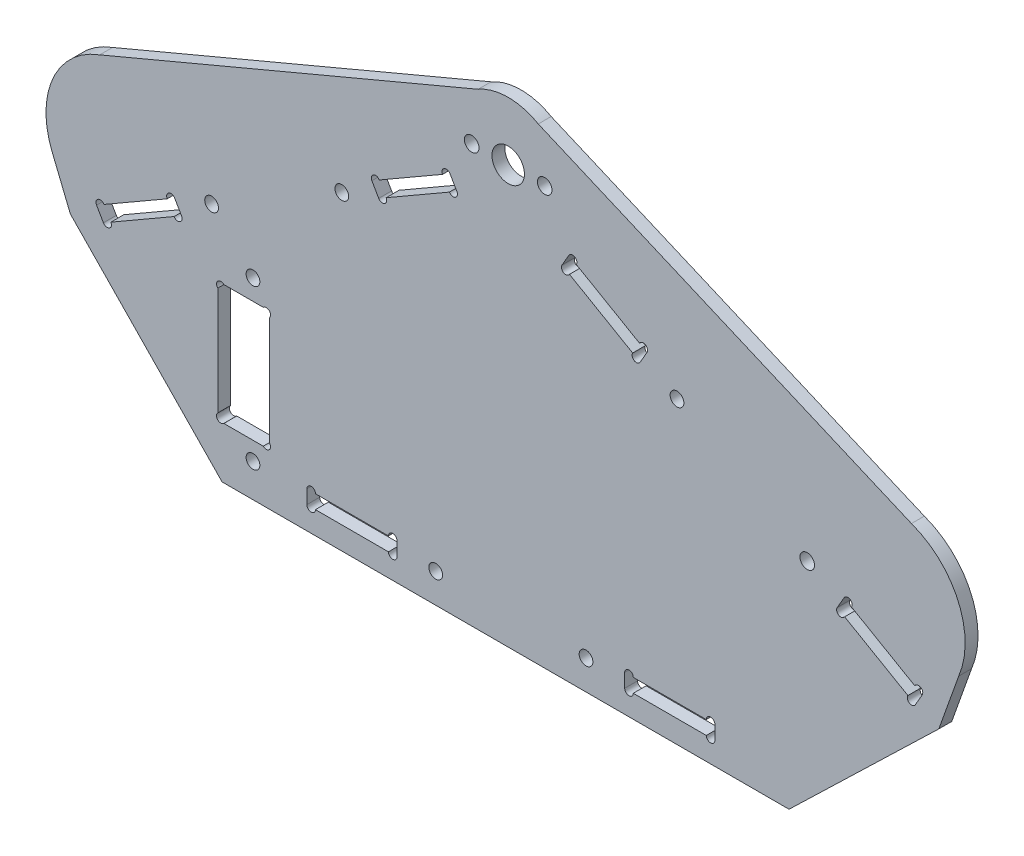
from build123d import *

# Parameters (mm, degrees)
MODEL_R             = 3.781579339
MODEL_R_2           = 1.7
MODEL_R_3           = 1.6
MODEL_W             = 12
MODEL_H             = 28
BOSS_EXTRUDE2_DEPTH = 3
SKETCH1_R           = 1.0005
CUT_EXTRUDE1_DEPTH  = 312.964229084


with BuildPart() as part:
    # Model → Boss-Extrude2 (new body)
    with BuildSketch(Plane.XY):
        with BuildLine():
            Line((88, 60), (220, 60))
            Line((220, 60), (254.882583618, 93.640518188))
            Line((254.882583618, 93.640518188), (259.489592216, 106.576108559))
            ThreePointArc((259.489592216, 106.576108559), (259.424141413, 121.57623231), (248.498382723, 131.854159795))
            Line((248.498382723, 131.854159795), (161.617078665, 168.980084934))
            ThreePointArc((161.617078665, 168.980084934), (154.617078665, 170.855729281), (147.617078665, 168.980084934))
            Line((147.617078665, 168.980084934), (59.501617277, 131.854159795))
            ThreePointArc((59.501617277, 131.854159795), (48.575858587, 121.57623231), (48.510407784, 106.576108559))
            Line((48.510407784, 106.576108559), (52.677086204, 96.362955936))
            Line((52.677086204, 96.362955936), (88, 60))
        make_face()
        with Locations((154.617078665, 157.237991333)):
            Circle(MODEL_R, mode=Mode.SUBTRACT)
        with Locations((163.114624023, 157.237991333)):
            Circle(MODEL_R_2, mode=Mode.SUBTRACT)
        with Locations((146.117078665, 157.237991333)):
            Circle(MODEL_R_2, mode=Mode.SUBTRACT)
        with Locations((115.877120948, 132.296819167)):
            Circle(MODEL_R_3, mode=Mode.SUBTRACT)
        with Locations((137.734977924, 66.871509225)):
            Circle(MODEL_R_3, mode=Mode.SUBTRACT)
        with Locations((193.918561918, 129.673741782)):
            Circle(MODEL_R_3, mode=Mode.SUBTRACT)
        with Locations((172.735008, 66.871509225)):
            Circle(MODEL_R_3, mode=Mode.SUBTRACT)
        with Locations((95.2, 104.75)):
            Circle(MODEL_R_3, mode=Mode.SUBTRACT)
        with Locations((85.560630532, 114.806524888)):
            Circle(MODEL_R_3, mode=Mode.SUBTRACT)
        with Locations((224.233700932, 112.158328537)):
            Circle(MODEL_R_2, mode=Mode.SUBTRACT)
        with Locations((95.2, 67.75)):
            Circle(MODEL_R_3, mode=Mode.SUBTRACT)
        with Locations((93, 86)):
            Rectangle(MODEL_W, MODEL_H, mode=Mode.SUBTRACT)
        Polygon((181.734462562, 65.257395619), (181.735489, 68.457395619), (202.735488, 68.450659619), (202.734461562, 65.250659619), align=None, mode=Mode.SUBTRACT)
        Polygon((249.399348556, 95.770313962), (231.216181373, 106.276143646), (232.817069658, 109.046911896), (251.000236841, 98.541082213), align=None, mode=Mode.SUBTRACT)
        Polygon((60.374623433, 98.42894725), (58.775510803, 101.200740676), (76.965405371, 111.694917426), (78.564518, 108.923124), align=None, mode=Mode.SUBTRACT)
        Polygon((128.734464562, 65.274396), (128.735491, 68.474396), (107.735493, 68.481132), (107.734466562, 65.281132), align=None, mode=Mode.SUBTRACT)
        Polygon((142.66224045, 145.902603249), (124.4723462, 135.408426681), (122.873233571, 138.180220108), (136.035908619, 145.774076024), (141.063127638, 148.674396991), align=None, mode=Mode.SUBTRACT)
        Polygon((167.142166, 143.296685), (168.743054285, 146.067453251), (186.926220285, 135.561624251), (185.325332, 132.790856), align=None, mode=Mode.SUBTRACT)
    extrude(amount=BOSS_EXTRUDE2_DEPTH)

    # Sketch1 → Cut-Extrude1 (cut, through all)
    with BuildSketch(Plane.XY.offset(3)):
        with Locations((61.241241971, 98.928919808)):
            Circle(SKETCH1_R)
        with Locations((59.642129342, 101.700713234)):
            Circle(SKETCH1_R)
        with Locations((76.098786832, 111.194944868)):
            Circle(SKETCH1_R)
        with Locations((77.697899462, 108.423151442)):
            Circle(SKETCH1_R)
        with Locations((87.707460335, 99.292539665)):
            Circle(SKETCH1_R)
        with Locations((98.292539665, 99.292539665)):
            Circle(SKETCH1_R)
        with Locations((87.707460335, 72.707460335)):
            Circle(SKETCH1_R)
        with Locations((98.292539665, 72.707460335)):
            Circle(SKETCH1_R)
        with Locations((108.735992948, 68.480811078)):
            Circle(SKETCH1_R)
        with Locations((108.73496651, 65.280811078)):
            Circle(SKETCH1_R)
        with Locations((127.733964613, 65.274716923)):
            Circle(SKETCH1_R)
        with Locations((127.734991051, 68.474716923)):
            Circle(SKETCH1_R)
        with Locations((182.73496251, 65.257074697)):
            Circle(SKETCH1_R)
        with Locations((182.735988949, 68.457074697)):
            Circle(SKETCH1_R)
        with Locations((201.734988051, 68.450980541)):
            Circle(SKETCH1_R)
        with Locations((201.733961613, 65.250980541)):
            Circle(SKETCH1_R)
        with Locations((232.082479384, 105.775615918)):
            Circle(SKETCH1_R)
        with Locations((233.683367669, 108.546384168)):
            Circle(SKETCH1_R)
        with Locations((250.13393883, 99.041609941)):
            Circle(SKETCH1_R)
        with Locations((248.533050545, 96.27084169)):
            Circle(SKETCH1_R)
        with Locations((168.008464011, 142.796157272)):
            Circle(SKETCH1_R)
        with Locations((169.609352296, 145.566925523)):
            Circle(SKETCH1_R)
        with Locations((184.459033989, 133.291383728)):
            Circle(SKETCH1_R)
        with Locations((186.059922274, 136.062151978)):
            Circle(SKETCH1_R)
        with Locations((141.795621912, 145.402630691)):
            Circle(SKETCH1_R)
        with Locations((140.196509099, 148.174424012)):
            Circle(SKETCH1_R)
        with Locations((123.739852109, 138.680192666)):
            Circle(SKETCH1_R)
        with Locations((125.338964739, 135.90839924)):
            Circle(SKETCH1_R)
    extrude(amount=-CUT_EXTRUDE1_DEPTH, mode=Mode.SUBTRACT)


solid = part.part
